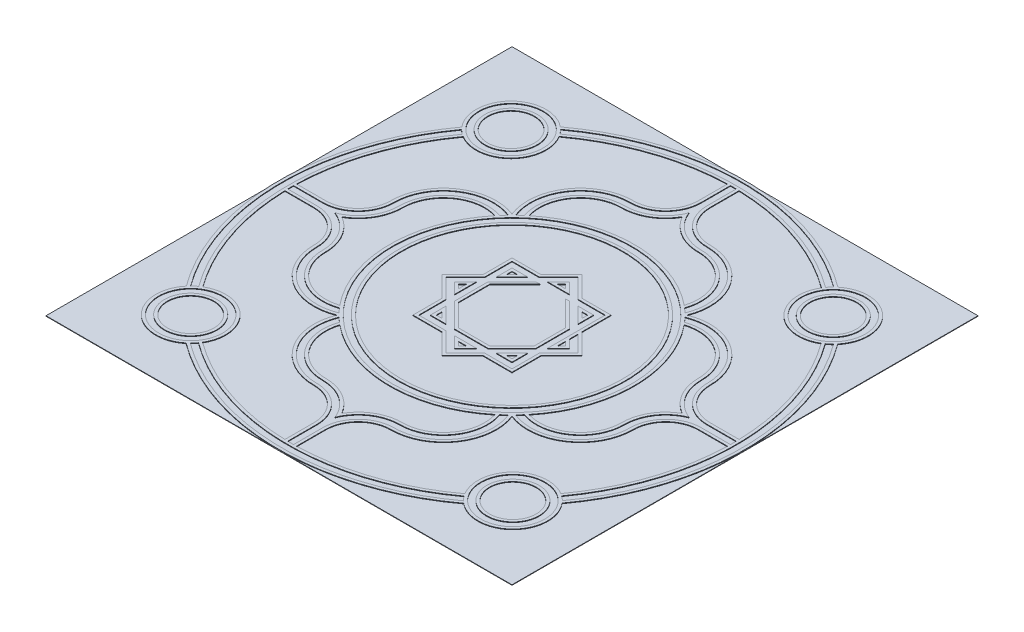
from build123d import *

# Parameters (mm, degrees)
SKETCH1_W           = 203.2
SKETCH1_H           = 203.2
BOSS_EXTRUDE1_DEPTH = 0.2032
SKETCH2_R           = 13.97
SKETCH2_R_2         = 11.43
SKETCH2_R_3         = 10.16
BOSS_EXTRUDE2_DEPTH = 0.254
SKETCH2_7_R         = 52.07
SKETCH2_7_R_2       = 49.53
SKETCH2_7_R_3       = 48.26
BOSS_EXTRUDE3_DEPTH = 0.254


with BuildPart() as part:
    # Sketch1 → Boss-Extrude1 (new body)
    with BuildSketch(Plane(origin=(0, 0, 0), x_dir=(1, 0, 0), z_dir=(0, 1, 0))):
        Rectangle(SKETCH1_W, SKETCH1_H)
    extrude(amount=BOSS_EXTRUDE1_DEPTH)

    # Sketch2 → Boss-Extrude2 (add)
    # profile 1 of 5: a face of its own
    with BuildSketch(Plane(origin=(0, 0.2032, 0), x_dir=(1, 0, 0), z_dir=(0, 1, 0))):
        with BuildLine():
            ThreePointArc((60.533643968, 81.598026618), (0, 101.6), (-60.533643968, 81.598026618))
            ThreePointArc((-60.533643968, 81.598026618), (-81.047825296, 80.596153846), (-81.935040384, 60.07669396))
            ThreePointArc((-81.935040384, 60.07669396), (-101.6, 0), (-81.935040384, -60.07669396))
            ThreePointArc((-81.935040384, -60.07669396), (-81.047825296, -80.596153846), (-60.533643968, -81.598026618))
            ThreePointArc((-60.533643968, -81.598026618), (0, -101.6), (60.533643968, -81.598026618))
            ThreePointArc((60.533643968, -81.598026618), (81.047825296, -80.596153846), (81.935040384, -60.07669396))
            ThreePointArc((81.935040384, -60.07669396), (101.6, 0), (81.935040384, 60.07669396))
            ThreePointArc((81.935040384, 60.07669396), (81.047825296, 80.596153846), (60.533643968, 81.598026618))
        make_face()
        with BuildLine():
            ThreePointArc((-1.27, 96.511644375), (29.499641146, 91.90147753), (57.204014407, 77.741952225))
            ThreePointArc((57.204014407, 77.741952225), (59.435071884, 59.103846154), (78.060418808, 56.768665789))
            ThreePointArc((78.060418808, 56.768665789), (91.590811696, 30.450510881), (96.511644375, 1.27))
            ThreePointArc((96.511644375, 1.27), (91.983547402, -29.242732556), (78.060418808, -56.768665789))
            ThreePointArc((78.060418808, -56.768665789), (59.435071884, -59.103846154), (57.204014407, -77.741952225))
            ThreePointArc((57.204014407, -77.741952225), (30.706317364, -91.505368553), (1.27, -96.511644375))
            ThreePointArc((1.27, -96.511644375), (-29.499641146, -91.90147753), (-57.204014407, -77.741952225))
            ThreePointArc((-57.204014407, -77.741952225), (-59.435071884, -59.103846154), (-78.060418808, -56.768665789))
            ThreePointArc((-78.060418808, -56.768665789), (-91.590811696, -30.450510881), (-96.511644375, -1.27))
            ThreePointArc((-96.511644375, -1.27), (-91.983547402, 29.242732556), (-78.060418808, 56.768665789))
            ThreePointArc((-78.060418808, 56.768665789), (-59.435071884, 59.103846154), (-57.204014407, 77.741952225))
            ThreePointArc((-57.204014407, 77.741952225), (-30.706317364, 91.505368553), (-1.27, 96.511644375))
        make_face(mode=Mode.SUBTRACT)
        with BuildLine():
            ThreePointArc((57.907235379, 78.801244856), (0, 97.79), (-57.907235379, 78.801244856))
            ThreePointArc((-57.907235379, 78.801244856), (-58.698529617, 79.800810097), (-59.570598148, 80.730742201))
            ThreePointArc((-59.570598148, 80.730742201), (0, 100.33), (59.570598148, 80.730742201))
            ThreePointArc((59.570598148, 80.730742201), (58.698529617, 79.800810097), (57.907235379, 78.801244856))
        make_face(mode=Mode.SUBTRACT)
        with Locations((-70.24144859, 69.85)):
            Circle(SKETCH2_R, mode=Mode.SUBTRACT)
        with Locations((70.24144859, 69.85)):
            Circle(SKETCH2_R, mode=Mode.SUBTRACT)
        with BuildLine():
            ThreePointArc((-79.123624798, 57.465955999), (-97.79, 0), (-79.123624798, -57.465955999))
            ThreePointArc((-79.123624798, -57.465955999), (-80.127596521, -58.251651882), (-81.062387597, -59.118509936))
            ThreePointArc((-81.062387597, -59.118509936), (-100.33, 0), (-81.062387597, 59.118509936))
            ThreePointArc((-81.062387597, 59.118509936), (-80.127596521, 58.251651882), (-79.123624798, 57.465955999))
        make_face(mode=Mode.SUBTRACT)
        with BuildLine():
            ThreePointArc((79.123624798, 57.465955999), (80.127596521, 58.251651882), (81.062387597, 59.118509936))
            ThreePointArc((81.062387597, 59.118509936), (100.33, 0), (81.062387597, -59.118509936))
            ThreePointArc((81.062387597, -59.118509936), (80.127596521, -58.251651882), (79.123624798, -57.465955999))
            ThreePointArc((79.123624798, -57.465955999), (97.79, 0), (79.123624798, 57.465955999))
        make_face(mode=Mode.SUBTRACT)
        with Locations((-70.24144859, -69.85)):
            Circle(SKETCH2_R, mode=Mode.SUBTRACT)
        with Locations((70.24144859, -69.85)):
            Circle(SKETCH2_R, mode=Mode.SUBTRACT)
        with BuildLine():
            ThreePointArc((-57.907235379, -78.801244856), (0, -97.79), (57.907235379, -78.801244856))
            ThreePointArc((57.907235379, -78.801244856), (58.698529617, -79.800810097), (59.570598148, -80.730742201))
            ThreePointArc((59.570598148, -80.730742201), (0, -100.33), (-59.570598148, -80.730742201))
            ThreePointArc((-59.570598148, -80.730742201), (-58.698529617, -79.800810097), (-57.907235379, -78.801244856))
        make_face(mode=Mode.SUBTRACT)
    # profile 2 of 5: a face of its own
    with BuildSketch(Plane(origin=(0, 0.2032, 0), x_dir=(1, 0, 0), z_dir=(0, 1, 0))):
        with Locations((-70.24144859, 69.85)):
            Circle(SKETCH2_R_2)
        with Locations((-70.24144859, 69.85)):
            Circle(SKETCH2_R_3, mode=Mode.SUBTRACT)
    # profile 3 of 5: a face of its own
    with BuildSketch(Plane(origin=(0, 0.2032, 0), x_dir=(1, 0, 0), z_dir=(0, 1, 0))):
        with Locations((70.24144859, 69.85)):
            Circle(SKETCH2_R_2)
        with Locations((70.24144859, 69.85)):
            Circle(SKETCH2_R_3, mode=Mode.SUBTRACT)
    # profile 4 of 5: a face of its own
    with BuildSketch(Plane(origin=(0, 0.2032, 0), x_dir=(1, 0, 0), z_dir=(0, 1, 0))):
        with Locations((-70.24144859, -69.85)):
            Circle(SKETCH2_R_2)
        with Locations((-70.24144859, -69.85)):
            Circle(SKETCH2_R_3, mode=Mode.SUBTRACT)
    # profile 5 of 5: a face of its own
    with BuildSketch(Plane(origin=(0, 0.2032, 0), x_dir=(1, 0, 0), z_dir=(0, 1, 0))):
        with Locations((70.24144859, -69.85)):
            Circle(SKETCH2_R_2)
        with Locations((70.24144859, -69.85)):
            Circle(SKETCH2_R_3, mode=Mode.SUBTRACT)
    extrude(amount=BOSS_EXTRUDE2_DEPTH)

    # Sketch2<7> → Boss-Extrude3 (add)
    # profile 1 of 11: a face of its own
    with BuildSketch(Plane(origin=(0, 0.2032, 0), x_dir=(1, 0, 0), z_dir=(0, 1, 0))):
        with BuildLine():
            Line((-1.27, 83.82), (-1.27, 96.511644375))
            ThreePointArc((-1.27, 96.511644375), (-1.905041244, 96.501198013), (-2.54, 96.486573159))
            Line((-2.54, 96.486573159), (-2.54, 83.82))
            ThreePointArc((-2.54, 83.82), (-6.706113144, 73.762113144), (-16.764, 69.596))
            ThreePointArc((-16.764, 69.596), (-35.778671281, 59.531885896), (-38.149056564, 38.149056564))
            ThreePointArc((-38.149056564, 38.149056564), (-59.531885896, 35.778671281), (-69.596, 16.764))
            ThreePointArc((-69.596, 16.764), (-73.762113144, 6.706113144), (-83.82, 2.54))
            Line((-83.82, 2.54), (-96.486573159, 2.54))
            ThreePointArc((-96.486573159, 2.54), (-96.501198013, 1.905041244), (-96.511644375, 1.27))
            Line((-96.511644375, 1.27), (-83.82, 1.27))
            ThreePointArc((-83.82, 1.27), (-72.864087532, 5.808087532), (-68.326, 16.764))
            ThreePointArc((-68.326, 16.764), (-58.76479728, 34.764372056), (-38.497072786, 36.920603827))
            ThreePointArc((-38.497072786, 36.920603827), (-39.431261208, 35.921180932), (-40.339511597, 34.898128949))
            ThreePointArc((-40.339511597, 34.898128949), (-57.73509319, 32.387463163), (-65.786, 16.764))
            ThreePointArc((-65.786, 16.764), (-68.901691231, 6.631417926), (-77.172183817, 0))
            ThreePointArc((-77.172183817, 0), (-68.901691231, -6.631417926), (-65.786, -16.764))
            ThreePointArc((-65.786, -16.764), (-57.73509319, -32.387463163), (-40.339511597, -34.898128949))
            ThreePointArc((-40.339511597, -34.898128949), (-39.431261208, -35.921180932), (-38.497072786, -36.920603827))
            ThreePointArc((-38.497072786, -36.920603827), (-58.76479728, -34.764372056), (-68.326, -16.764))
            ThreePointArc((-68.326, -16.764), (-72.864087532, -5.808087532), (-83.82, -1.27))
            Line((-83.82, -1.27), (-96.511644375, -1.27))
            ThreePointArc((-96.511644375, -1.27), (-96.501198013, -1.905041244), (-96.486573159, -2.54))
            Line((-96.486573159, -2.54), (-83.82, -2.54))
            ThreePointArc((-83.82, -2.54), (-73.762113144, -6.706113144), (-69.596, -16.764))
            ThreePointArc((-69.596, -16.764), (-59.531885896, -35.778671281), (-38.149056564, -38.149056564))
            ThreePointArc((-38.149056564, -38.149056564), (-35.778671281, -59.531885896), (-16.764, -69.596))
            ThreePointArc((-16.764, -69.596), (-6.706113144, -73.762113144), (-2.54, -83.82))
            Line((-2.54, -83.82), (-2.54, -96.486573159))
            ThreePointArc((-2.54, -96.486573159), (-1.905041244, -96.501198013), (-1.27, -96.511644375))
            Line((-1.27, -96.511644375), (-1.27, -83.82))
            ThreePointArc((-1.27, -83.82), (-5.808087532, -72.864087532), (-16.764, -68.326))
            ThreePointArc((-16.764, -68.326), (-34.764372056, -58.76479728), (-36.920603827, -38.497072786))
            ThreePointArc((-36.920603827, -38.497072786), (-35.921180932, -39.431261208), (-34.898128949, -40.339511597))
            ThreePointArc((-34.898128949, -40.339511597), (-32.387463163, -57.73509319), (-16.764, -65.786))
            ThreePointArc((-16.764, -65.786), (-6.631417926, -68.901691231), (0, -77.172183817))
            ThreePointArc((0, -77.172183817), (6.631417926, -68.901691231), (16.764, -65.786))
            ThreePointArc((16.764, -65.786), (32.387463163, -57.73509319), (34.898128949, -40.339511597))
            ThreePointArc((34.898128949, -40.339511597), (35.921180932, -39.431261208), (36.920603827, -38.497072786))
            ThreePointArc((36.920603827, -38.497072786), (34.764372056, -58.76479728), (16.764, -68.326))
            ThreePointArc((16.764, -68.326), (5.808087532, -72.864087532), (1.27, -83.82))
            Line((1.27, -83.82), (1.27, -96.511644375))
            ThreePointArc((1.27, -96.511644375), (1.905041244, -96.501198013), (2.54, -96.486573159))
            Line((2.54, -96.486573159), (2.54, -83.82))
            ThreePointArc((2.54, -83.82), (6.706113144, -73.762113144), (16.764, -69.596))
            ThreePointArc((16.764, -69.596), (35.778671281, -59.531885896), (38.149056564, -38.149056564))
            ThreePointArc((38.149056564, -38.149056564), (59.531885896, -35.778671281), (69.596, -16.764))
            ThreePointArc((69.596, -16.764), (73.762113144, -6.706113144), (83.82, -2.54))
            Line((83.82, -2.54), (96.486573159, -2.54))
            ThreePointArc((96.486573159, -2.54), (96.501198013, -1.905041244), (96.511644375, -1.27))
            Line((96.511644375, -1.27), (83.82, -1.27))
            ThreePointArc((83.82, -1.27), (72.864087532, -5.808087532), (68.326, -16.764))
            ThreePointArc((68.326, -16.764), (58.76479728, -34.764372056), (38.497072786, -36.920603827))
            ThreePointArc((38.497072786, -36.920603827), (39.431261208, -35.921180932), (40.339511597, -34.898128949))
            ThreePointArc((40.339511597, -34.898128949), (57.73509319, -32.387463163), (65.786, -16.764))
            ThreePointArc((65.786, -16.764), (68.901691231, -6.631417926), (77.172183817, 0))
            ThreePointArc((77.172183817, 0), (68.901691231, 6.631417926), (65.786, 16.764))
            ThreePointArc((65.786, 16.764), (57.73509319, 32.387463163), (40.339511597, 34.898128949))
            ThreePointArc((40.339511597, 34.898128949), (39.431261208, 35.921180932), (38.497072786, 36.920603827))
            ThreePointArc((38.497072786, 36.920603827), (58.76479728, 34.764372056), (68.326, 16.764))
            ThreePointArc((68.326, 16.764), (72.864087532, 5.808087532), (83.82, 1.27))
            Line((83.82, 1.27), (96.511644375, 1.27))
            ThreePointArc((96.511644375, 1.27), (96.501198013, 1.905041244), (96.486573159, 2.54))
            Line((96.486573159, 2.54), (83.82, 2.54))
            ThreePointArc((83.82, 2.54), (73.762113144, 6.706113144), (69.596, 16.764))
            ThreePointArc((69.596, 16.764), (59.531885896, 35.778671281), (38.149056564, 38.149056564))
            ThreePointArc((38.149056564, 38.149056564), (35.778671281, 59.531885896), (16.764, 69.596))
            ThreePointArc((16.764, 69.596), (6.706113144, 73.762113144), (2.54, 83.82))
            Line((2.54, 83.82), (2.54, 96.486573159))
            ThreePointArc((2.54, 96.486573159), (1.905041244, 96.501198013), (1.27, 96.511644375))
            Line((1.27, 96.511644375), (1.27, 83.82))
            ThreePointArc((1.27, 83.82), (5.808087532, 72.864087532), (16.764, 68.326))
            ThreePointArc((16.764, 68.326), (34.764372056, 58.76479728), (36.920603827, 38.497072786))
            ThreePointArc((36.920603827, 38.497072786), (35.921180932, 39.431261208), (34.898128949, 40.339511597))
            ThreePointArc((34.898128949, 40.339511597), (32.387463163, 57.73509319), (16.764, 65.786))
            ThreePointArc((16.764, 65.786), (6.631417926, 68.901691231), (0, 77.172183817))
            ThreePointArc((0, 77.172183817), (-6.631417926, 68.901691231), (-16.764, 65.786))
            ThreePointArc((-16.764, 65.786), (-32.387463163, 57.73509319), (-34.898128949, 40.339511597))
            ThreePointArc((-34.898128949, 40.339511597), (-35.921180932, 39.431261208), (-36.920603827, 38.497072786))
            ThreePointArc((-36.920603827, 38.497072786), (-34.764372056, 58.76479728), (-16.764, 68.326))
            ThreePointArc((-16.764, 68.326), (-5.808087532, 72.864087532), (-1.27, 83.82))
        make_face()
        with BuildLine():
            ThreePointArc((33.85191144, 41.22139847), (0, 53.34), (-33.85191144, 41.22139847))
            ThreePointArc((-33.85191144, 41.22139847), (-31.209026634, 57.197469446), (-16.764, 64.516))
            ThreePointArc((-16.764, 64.516), (-7.071810367, 67.125513601), (0, 74.24854661))
            ThreePointArc((0, 74.24854661), (7.071810367, 67.125513601), (16.764, 64.516))
            ThreePointArc((16.764, 64.516), (31.209026634, 57.197469446), (33.85191144, 41.22139847))
        make_face(mode=Mode.SUBTRACT)
        with BuildLine():
            ThreePointArc((41.22139847, 33.85191144), (57.197469446, 31.209026634), (64.516, 16.764))
            ThreePointArc((64.516, 16.764), (67.125513601, 7.071810367), (74.24854661, 0))
            ThreePointArc((74.24854661, 0), (67.125513601, -7.071810367), (64.516, -16.764))
            ThreePointArc((64.516, -16.764), (57.197469446, -31.209026634), (41.22139847, -33.85191144))
            ThreePointArc((41.22139847, -33.85191144), (53.34, 0), (41.22139847, 33.85191144))
        make_face(mode=Mode.SUBTRACT)
        with BuildLine():
            ThreePointArc((-33.85191144, -41.22139847), (0, -53.34), (33.85191144, -41.22139847))
            ThreePointArc((33.85191144, -41.22139847), (31.209026634, -57.197469446), (16.764, -64.516))
            ThreePointArc((16.764, -64.516), (7.071810367, -67.125513601), (0, -74.24854661))
            ThreePointArc((0, -74.24854661), (-7.071810367, -67.125513601), (-16.764, -64.516))
            ThreePointArc((-16.764, -64.516), (-31.209026634, -57.197469446), (-33.85191144, -41.22139847))
        make_face(mode=Mode.SUBTRACT)
        with BuildLine():
            ThreePointArc((-41.22139847, 33.85191144), (-53.34, 0), (-41.22139847, -33.85191144))
            ThreePointArc((-41.22139847, -33.85191144), (-57.197469446, -31.209026634), (-64.516, -16.764))
            ThreePointArc((-64.516, -16.764), (-67.125513601, -7.071810367), (-74.24854661, 0))
            ThreePointArc((-74.24854661, 0), (-67.125513601, 7.071810367), (-64.516, 16.764))
            ThreePointArc((-64.516, 16.764), (-57.197469446, 31.209026634), (-41.22139847, 33.85191144))
        make_face(mode=Mode.SUBTRACT)
        Circle(SKETCH2_7_R, mode=Mode.SUBTRACT)
    # profile 2 of 11: a face of its own
    with BuildSketch(Plane(origin=(0, 0.2032, 0), x_dir=(1, 0, 0), z_dir=(0, 1, 0))):
        Circle(SKETCH2_7_R_2)
        Circle(SKETCH2_7_R_3, mode=Mode.SUBTRACT)
    # profile 3 of 11: a face of its own
    with BuildSketch(Plane(origin=(0, 0.2032, 0), x_dir=(1, 0, 0), z_dir=(0, 1, 0))):
        Polygon((-21.59, 21.59), (-21.59, 8.942870812), (-30.532870812, 0), (-21.59, -8.942870812), (-21.59, -21.59), (-8.942870812, -21.59), (0, -30.532870812), (8.942870812, -21.59), (21.59, -21.59), (21.59, -8.942870812), (30.532870812, 0), (21.59, 8.942870812), (21.59, 21.59), (8.942870812, 21.59), (0, 30.532870812), (-8.942870812, 21.59), align=None)
        Polygon((-20.32, 20.32), (-8.416819587, 20.32), (0, 28.736819587), (8.416819587, 20.32), (20.32, 20.32), (20.32, -4.824717139), (25.144717139, 0), (21.59, 3.554717139), (21.59, 7.146819587), (28.736819587, 0), (20.32, -8.416819587), (20.32, -20.32), (8.416819587, -20.32), (0, -28.736819587), (-8.416819587, -20.32), (-20.32, -20.32), (-20.32, -8.416819587), (-28.736819587, 0), (-20.32, 8.416819587), align=None, mode=Mode.SUBTRACT)
        Polygon((23.348665915, 0), (21.59, -1.758665915), (21.59, 1.758665915), align=None, mode=Mode.SUBTRACT)
    # profile 4 of 11: a face of its own
    with BuildSketch(Plane(origin=(0, 0.2032, 0), x_dir=(1, 0, 0), z_dir=(0, 1, 0))):
        Polygon((17.78, -10.956819587), (10.956819587, -17.78), (17.78, -17.78), align=None)
        Polygon((16.51, -16.51), (14.022870812, -16.51), (16.51, -14.022870812), align=None, mode=Mode.SUBTRACT)
    # profile 5 of 11: a face of its own
    with BuildSketch(Plane(origin=(0, 0.2032, 0), x_dir=(1, 0, 0), z_dir=(0, 1, 0))):
        Polygon((0, -25.144717139), (4.824717139, -20.32), (-4.824717139, -20.32), align=None)
        Polygon((0, -23.348665915), (-1.758665915, -21.59), (1.758665915, -21.59), align=None, mode=Mode.SUBTRACT)
    # profile 6 of 11: a face of its own
    with BuildSketch(Plane(origin=(0, 0.2032, 0), x_dir=(1, 0, 0), z_dir=(0, 1, 0))):
        Polygon((-17.78, -17.78), (-10.956819587, -17.78), (-17.78, -10.956819587), align=None)
        Polygon((-16.51, -16.51), (-16.51, -14.022870812), (-14.022870812, -16.51), align=None, mode=Mode.SUBTRACT)
    # profile 7 of 11: a face of its own
    with BuildSketch(Plane(origin=(0, 0.2032, 0), x_dir=(1, 0, 0), z_dir=(0, 1, 0))):
        Polygon((10.956819587, 17.78), (17.78, 10.956819587), (17.78, 17.78), align=None)
        Polygon((16.51, 16.51), (16.51, 14.022870812), (14.022870812, 16.51), align=None, mode=Mode.SUBTRACT)
    # profile 8 of 11: a face of its own
    with BuildSketch(Plane(origin=(0, 0.2032, 0), x_dir=(1, 0, 0), z_dir=(0, 1, 0))):
        Polygon((-5.568665915, 17.78), (-7.364717139, 17.78), (-17.78, 7.364717139), (-17.78, -7.364717139), (-7.364717139, -17.78), (7.364717139, -17.78), (17.78, -7.364717139), (17.78, 7.364717139), (7.364717139, 17.78), (5.568665915, 17.78), (16.51, 6.838665915), (16.51, -6.838665915), (6.838665915, -16.51), (-6.838665915, -16.51), (-16.51, -6.838665915), (-16.51, 6.838665915), align=None)
    # profile 9 of 11: a face of its own
    with BuildSketch(Plane(origin=(0, 0.2032, 0), x_dir=(1, 0, 0), z_dir=(0, 1, 0))):
        Polygon((-20.32, 4.824717139), (-25.144717139, 0), (-20.32, -4.824717139), align=None)
        Polygon((-21.59, 1.758665915), (-21.59, -1.758665915), (-23.348665915, 0), align=None, mode=Mode.SUBTRACT)
    # profile 10 of 11: a face of its own
    with BuildSketch(Plane(origin=(0, 0.2032, 0), x_dir=(1, 0, 0), z_dir=(0, 1, 0))):
        Polygon((-4.824717139, 20.32), (4.824717139, 20.32), (0, 25.144717139), align=None)
        Polygon((0, 23.348665915), (1.758665915, 21.59), (-1.758665915, 21.59), align=None, mode=Mode.SUBTRACT)
    # profile 11 of 11: a face of its own
    with BuildSketch(Plane(origin=(0, 0.2032, 0), x_dir=(1, 0, 0), z_dir=(0, 1, 0))):
        Polygon((-17.78, 17.78), (-17.78, 10.956819587), (-10.956819587, 17.78), align=None)
        Polygon((-16.51, 16.51), (-14.022870812, 16.51), (-16.51, 14.022870812), align=None, mode=Mode.SUBTRACT)
    extrude(amount=BOSS_EXTRUDE3_DEPTH)


solid = part.part
